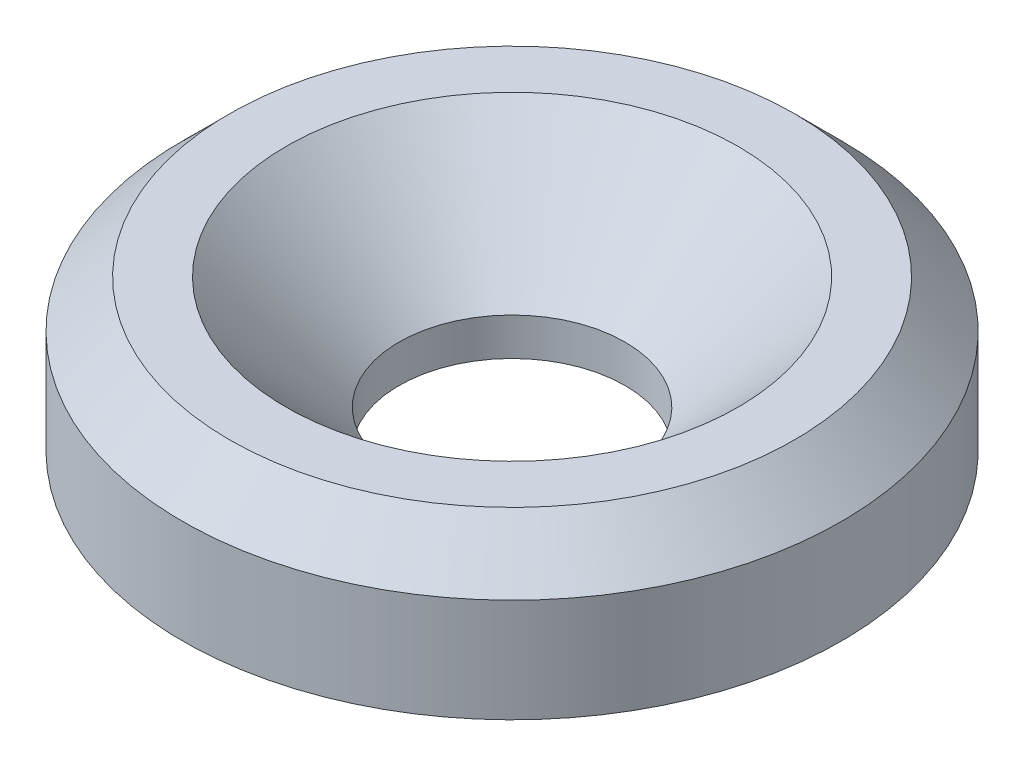
from build123d import *


with BuildPart() as part:
    # Sketch1 → Revolve1 (revolve)
    with BuildSketch(Plane.XY, mode=Mode.PRIVATE) as revolve1_sk:
        Polygon((6, 0), (17.5, 0), (17.5, 5.5), (15, 8), (12, 8), (6, 2), align=None)
    revolve(revolve1_sk.sketch.rotate(Axis((0, 0, 0), (0, 1, 0)), 90), axis=Axis((0, 0, 0), (0, 1, 0)))


solid = part.part
